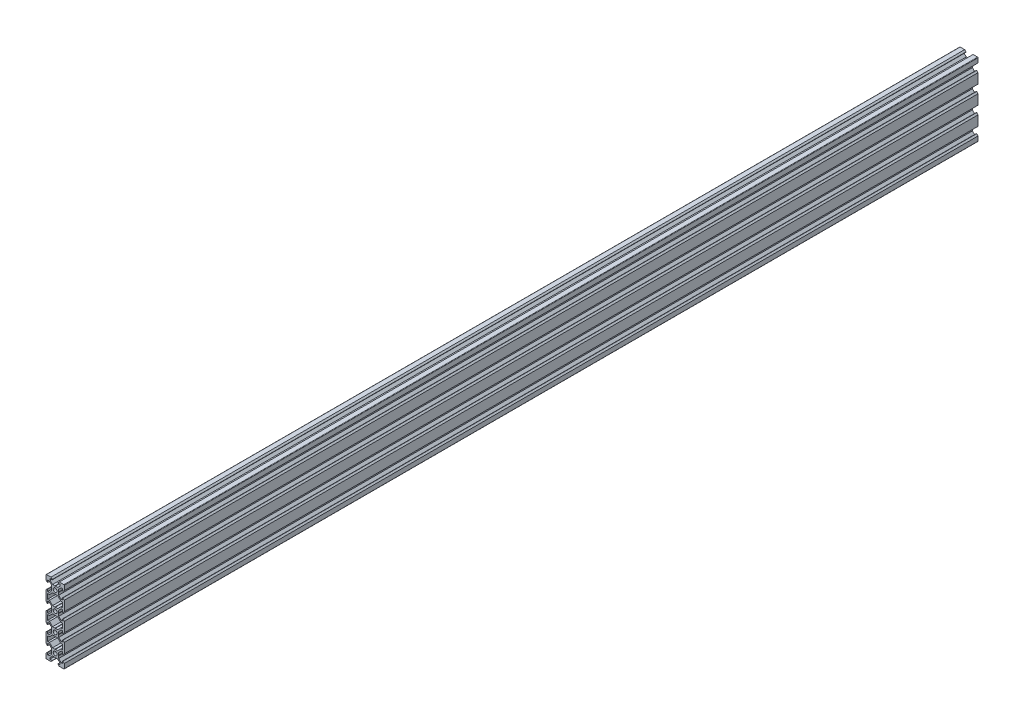
from build123d import *

# Parameters (mm, degrees)
BOSS_EXTRU_1_DEPTH = 1000


with BuildPart() as part:
    # Esquisse1 → Boss.-Extru.1 (new body)
    with BuildSketch(Plane.XY):
        with BuildLine():
            Line((-9.5, 10), (-4.58, 10))
            Line((-4.58, 10), (-3.125, 8.545))
            Line((-3.125, 8.545), (-3.125, 8.2))
            Line((-3.125, 8.2), (-5.5, 8.2))
            Line((-5.5, 8.2), (-5.5, 6.560660172))
            Line((-5.5, 6.560660172), (-2.839339828, 3.9))
            Line((-2.839339828, 3.9), (-0.21, 3.9))
            Line((-0.21, 3.9), (0, 3.69))
            Line((0, 3.69), (0, 2.1))
            ThreePointArc((0, 2.1), (-2.1, 0), (0, -2.1))
            Line((0, -2.1), (0, -3.69))
            Line((0, -3.69), (-0.21, -3.9))
            Line((-0.21, -3.9), (-2.839339828, -3.9))
            Line((-2.839339828, -3.9), (-6.239339828, -7.3))
            Line((-6.239339828, -7.3), (-8.2, -7.3))
            Line((-8.2, -7.3), (-8.2, -12.7))
            Line((-8.2, -12.7), (-6.239339828, -12.7))
            Line((-6.239339828, -12.7), (-2.839339828, -16.1))
            Line((-2.839339828, -16.1), (-0.21, -16.1))
            Line((-0.21, -16.1), (0, -16.31))
            Line((0, -16.31), (0, -17.9))
            ThreePointArc((0, -17.9), (-2.1, -20), (0, -22.1))
            Line((0, -22.1), (0, -23.69))
            Line((0, -23.69), (-0.21, -23.9))
            Line((-0.21, -23.9), (-2.839339828, -23.9))
            Line((-2.839339828, -23.9), (-6.239339828, -27.3))
            Line((-6.239339828, -27.3), (-8.2, -27.3))
            Line((-8.2, -27.3), (-8.2, -32.7))
            Line((-8.2, -32.7), (-6.239339828, -32.7))
            Line((-6.239339828, -32.7), (-2.839339828, -36.1))
            Line((-2.839339828, -36.1), (-0.21, -36.1))
            Line((-0.21, -36.1), (0, -36.31))
            Line((0, -36.31), (0, -37.9))
            ThreePointArc((0, -37.9), (-2.1, -40), (0, -42.1))
            Line((0, -42.1), (0, -43.69))
            Line((0, -43.69), (-0.21, -43.9))
            Line((-0.21, -43.9), (-2.839339828, -43.9))
            Line((-2.839339828, -43.9), (-6.239339828, -47.3))
            Line((-6.239339828, -47.3), (-8.2, -47.3))
            Line((-8.2, -47.3), (-8.2, -52.7))
            Line((-8.2, -52.7), (-6.239339828, -52.7))
            Line((-6.239339828, -52.7), (-2.839339828, -56.1))
            Line((-2.839339828, -56.1), (-0.21, -56.1))
            Line((-0.21, -56.1), (0, -56.31))
            Line((0, -56.31), (0, -57.9))
            ThreePointArc((0, -57.9), (-2.1, -60), (0, -62.1))
            Line((0, -62.1), (0, -63.69))
            Line((0, -63.69), (-0.21, -63.9))
            Line((-0.21, -63.9), (-2.839339828, -63.9))
            Line((-2.839339828, -63.9), (-5.5, -66.560660172))
            Line((-5.5, -66.560660172), (-5.5, -68.2))
            Line((-5.5, -68.2), (-3.125, -68.2))
            Line((-3.125, -68.2), (-3.125, -68.545))
            Line((-3.125, -68.545), (-4.58, -70))
            Line((-4.58, -70), (-9.5, -70))
            ThreePointArc((-9.5, -70), (-9.853553391, -69.853553391), (-10, -69.5))
            Line((-10, -69.5), (-10, -64.58))
            Line((-10, -64.58), (-8.545, -63.125))
            Line((-8.545, -63.125), (-8.2, -63.125))
            Line((-8.2, -63.125), (-8.2, -65.5))
            Line((-8.2, -65.5), (-6.560660172, -65.5))
            Line((-6.560660172, -65.5), (-3.9, -62.839339828))
            Line((-3.9, -62.839339828), (-3.9, -60.21))
            Line((-3.9, -60.21), (-3.69, -60))
            Line((-3.69, -60), (-3.9, -59.79))
            Line((-3.9, -59.79), (-3.9, -57.160660172))
            Line((-3.9, -57.160660172), (-6.560660172, -54.5))
            Line((-6.560660172, -54.5), (-8.2, -54.5))
            Line((-8.2, -54.5), (-8.2, -56.875))
            Line((-8.2, -56.875), (-8.545, -56.875))
            Line((-8.545, -56.875), (-10, -55.42))
            Line((-10, -55.42), (-10, -44.58))
            Line((-10, -44.58), (-8.545, -43.125))
            Line((-8.545, -43.125), (-8.2, -43.125))
            Line((-8.2, -43.125), (-8.2, -45.5))
            Line((-8.2, -45.5), (-6.560660172, -45.5))
            Line((-6.560660172, -45.5), (-3.9, -42.839339828))
            Line((-3.9, -42.839339828), (-3.9, -40.21))
            Line((-3.9, -40.21), (-3.69, -40))
            Line((-3.69, -40), (-3.9, -39.79))
            Line((-3.9, -39.79), (-3.9, -37.160660172))
            Line((-3.9, -37.160660172), (-6.560660172, -34.5))
            Line((-6.560660172, -34.5), (-8.2, -34.5))
            Line((-8.2, -34.5), (-8.2, -36.875))
            Line((-8.2, -36.875), (-8.545, -36.875))
            Line((-8.545, -36.875), (-10, -35.42))
            Line((-10, -35.42), (-10, -24.58))
            Line((-10, -24.58), (-8.545, -23.125))
            Line((-8.545, -23.125), (-8.2, -23.125))
            Line((-8.2, -23.125), (-8.2, -25.5))
            Line((-8.2, -25.5), (-6.560660172, -25.5))
            Line((-6.560660172, -25.5), (-3.9, -22.839339828))
            Line((-3.9, -22.839339828), (-3.9, -20.21))
            Line((-3.9, -20.21), (-3.69, -20))
            Line((-3.69, -20), (-3.9, -19.79))
            Line((-3.9, -19.79), (-3.9, -17.160660172))
            Line((-3.9, -17.160660172), (-6.560660172, -14.5))
            Line((-6.560660172, -14.5), (-8.2, -14.5))
            Line((-8.2, -14.5), (-8.2, -16.875))
            Line((-8.2, -16.875), (-8.545, -16.875))
            Line((-8.545, -16.875), (-10, -15.42))
            Line((-10, -15.42), (-10, -4.58))
            Line((-10, -4.58), (-8.545, -3.125))
            Line((-8.545, -3.125), (-8.2, -3.125))
            Line((-8.2, -3.125), (-8.2, -5.5))
            Line((-8.2, -5.5), (-6.560660172, -5.5))
            Line((-6.560660172, -5.5), (-3.9, -2.839339828))
            Line((-3.9, -2.839339828), (-3.9, -0.21))
            Line((-3.9, -0.21), (-3.69, 0))
            Line((-3.69, 0), (-3.9, 0.21))
            Line((-3.9, 0.21), (-3.9, 2.839339828))
            Line((-3.9, 2.839339828), (-6.560660172, 5.5))
            Line((-6.560660172, 5.5), (-8.2, 5.5))
            Line((-8.2, 5.5), (-8.2, 3.125))
            Line((-8.2, 3.125), (-8.545, 3.125))
            Line((-8.545, 3.125), (-10, 4.58))
            Line((-10, 4.58), (-10, 9.5))
            ThreePointArc((-10, 9.5), (-9.853553391, 9.853553391), (-9.5, 10))
        make_face()
    boss_extru_1 = extrude(amount=BOSS_EXTRU_1_DEPTH)

    # Symétrie1: Boss.-Extru.1 across Right Plane
    add(boss_extru_1.mirror(Plane(origin=(0, 0, 0), x_dir=(0, 0, -1), z_dir=(1, 0, 0))))


solid = part.part
